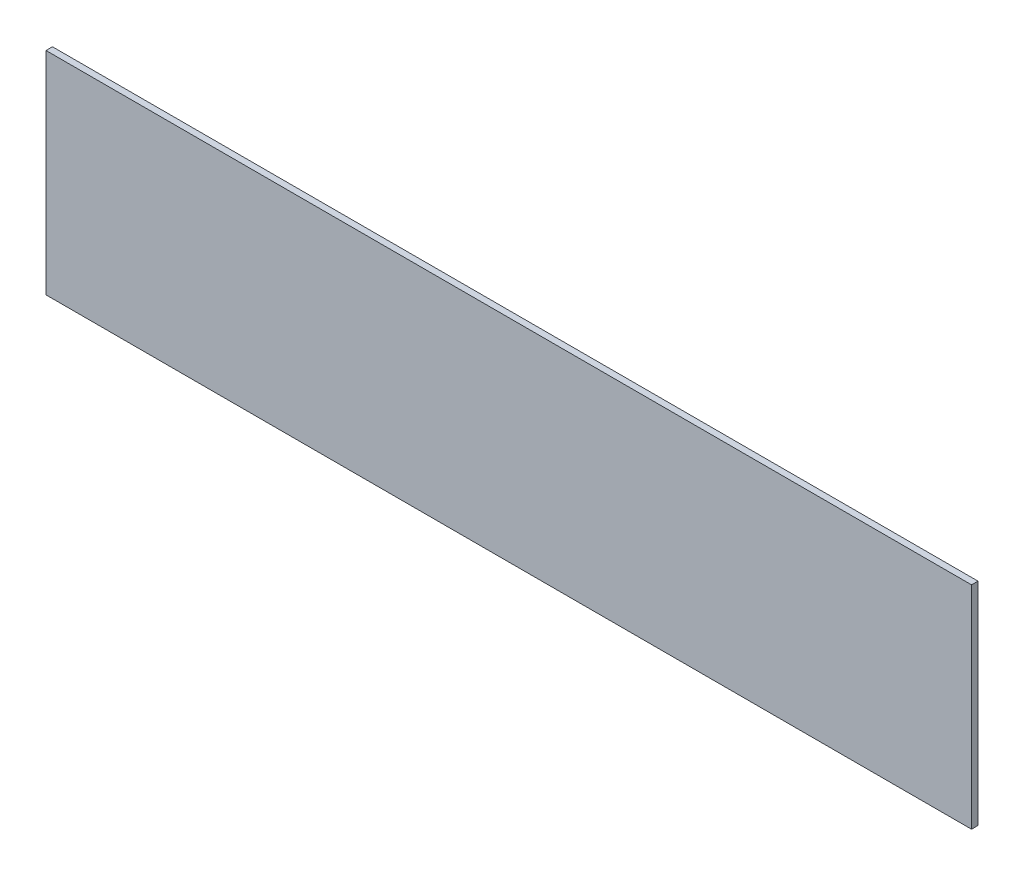
from build123d import *

# Parameters (mm, degrees)
ESQUISSE1_W        = 2580
ESQUISSE1_H        = 590
BOSS_EXTRU_1_DEPTH = 18


with BuildPart() as part:
    # Esquisse1 → Boss.-Extru.1 (new body)
    with BuildSketch(Plane.XY):
        with Locations((1290, 295)):
            Rectangle(ESQUISSE1_W, ESQUISSE1_H)
    extrude(amount=BOSS_EXTRU_1_DEPTH)


solid = part.part
